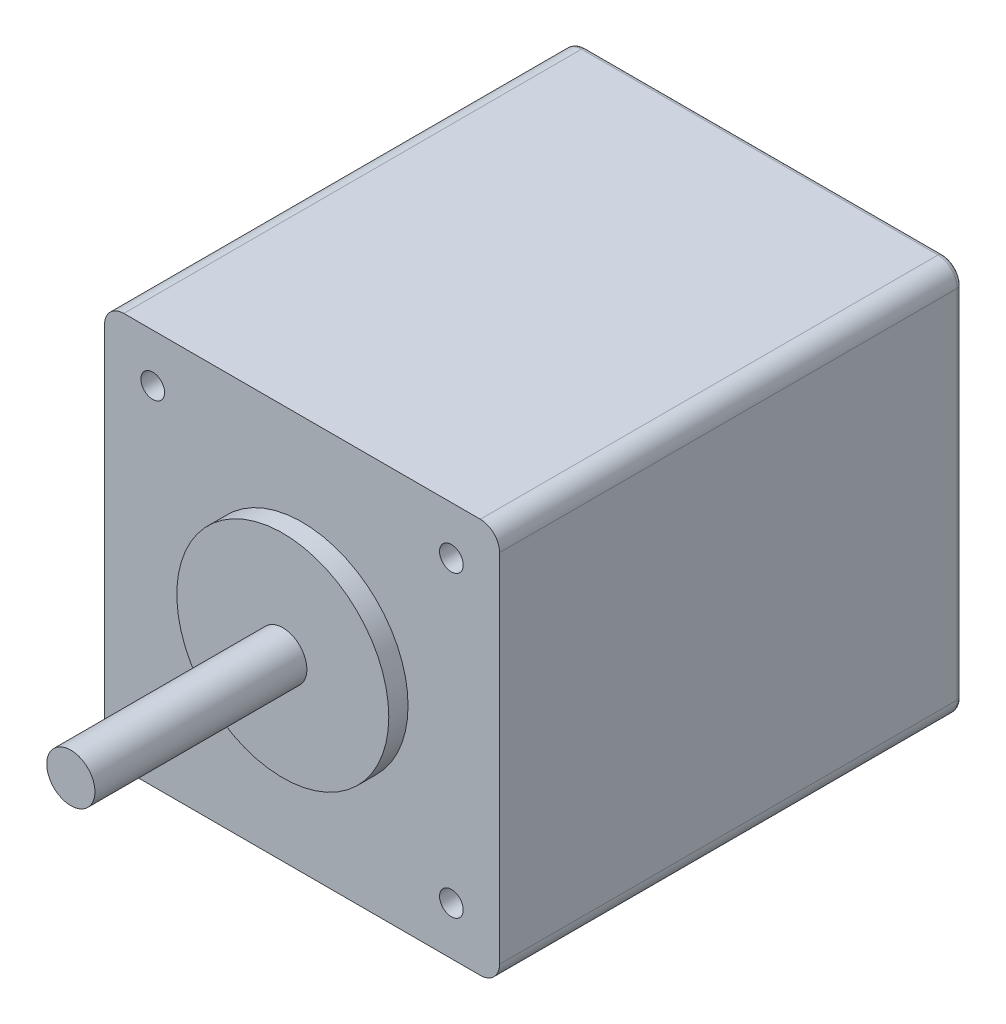
from build123d import *

# Parameters (mm, degrees)
SKETCH1_W                = 41
SKETCH1_H                = 48
BOSS_EXTRUDE1_DEPTH      = 41
M2_CLEARANCE_HOLE1_D     = 2.459
M2_CLEARANCE_HOLE1_DEPTH = 4.5
FILLET1_R                = 2
FILLET2_R                = 0.5


with BuildPart() as part:
    # Sketch1 → Boss-Extrude1 (new body)
    with BuildSketch(Plane(origin=(0, 41, 0), x_dir=(1, 0, 0), z_dir=(0, 1, 0))):
        with Locations((-20.5, -24)):
            Rectangle(SKETCH1_W, SKETCH1_H)
    extrude(amount=-BOSS_EXTRUDE1_DEPTH)

    # Sketch2 → Revolve1 (revolve)
    with BuildSketch(Plane(origin=(0, 20.5, 0), x_dir=(1, 0, 0), z_dir=(0, 1, 0))):
        Polygon((-9.5, -48), (-20.5, -48), (-20.5, -72), (-18, -72), (-18, -50), (-9.5, -50), align=None)
    revolve(axis=Axis((-20.5, 20.5, 48), (0, 0, 1)))

    # M2 Clearance Hole1
    with Locations(Plane.XY.offset(48)):
        with Locations((-36.000338928, 4.999660985), (-5.000129304, 5.00012938), (-4.999606235, 36.000393851), (-35.999364901, 35.999364804)):
            Hole(M2_CLEARANCE_HOLE1_D / 2, depth=M2_CLEARANCE_HOLE1_DEPTH)

    # Fillet1
    fillet1_edges = [part.edges().sort_by_distance(p)[0] for p in [
        (0, 0, 24),
        (-41, 0, 24),
        (0, 41, 24),
        (-41, 41, 24),
    ]]
    fillet(fillet1_edges, radius=FILLET1_R)

    # Fillet2
    fillet2_edges = [part.edges().sort_by_distance(p)[0] for p in [
        (-20.5, 41, 0),
        (-41, 20.5, 0),
        (0, 20.5, 0),
        (-20.5, 0, 0),
        (-0.585786438, 0.585786438, 0),
        (-40.414213562, 0.585786438, 0),
        (-0.585786438, 40.414213562, 0),
        (-40.414213562, 40.414213562, 0),
    ]]
    fillet(fillet2_edges, radius=FILLET2_R)


solid = part.part
